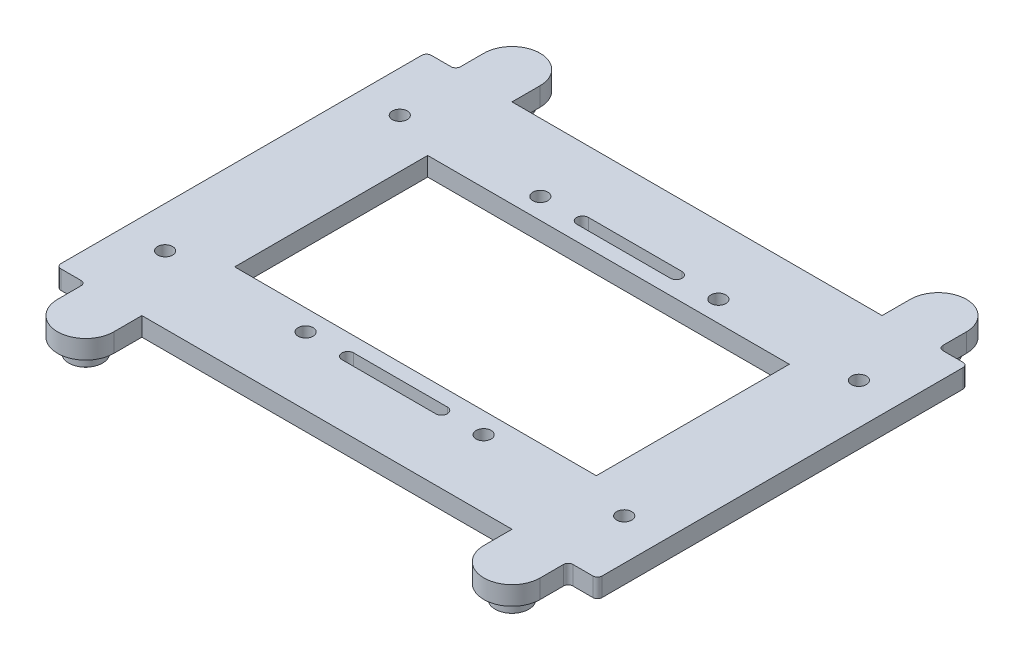
from build123d import *

# Parameters (mm, degrees)
EXTRUDE_1_DEPTH     = 4
SKETCH_4_R          = 3.6
EXTRUDE_2_DEPTH     = 3
EXTRUDE_2_2_DEPTH   = 3
EXTRUDE_2_3_DEPTH   = 3
EXTRUDE_2_4_DEPTH   = 3
SKETCH_5_R          = 1.8
EXTRUDE_3_DEPTH     = 1.3
EXTRUDE_3_2_DEPTH   = 1.3
EXTRUDE_3_3_DEPTH   = 1.3
EXTRUDE_3_4_DEPTH   = 1.3
SKETCH_10_W         = 77.2
SKETCH_10_H         = 41.2
CUT_EXTRUDE_5_DEPTH = 78.821606897
SKETCH_16_R         = 1.6
CUT_EXTRUDE_6_DEPTH = 10
FILLET_1_R          = 1


with BuildPart() as part:
    # 草图1 → 凸台-拉伸1 (new body)
    with BuildSketch(Plane(origin=(0, 0, 0), x_dir=(1, 0, 0), z_dir=(0, 1, 0))):
        with BuildLine():
            Line((-39.5, -39.5), (39.5, -39.5))
            Line((39.5, -39.5), (39.5, -45.5))
            ThreePointArc((39.5, -45.5), (45.5, -51.5), (51.5, -45.5))
            Line((51.5, -45.5), (51.5, -39.5))
            Line((51.5, -39.5), (57.75, -39.5))
            Line((57.75, -39.5), (57.75, 39.5))
            Line((57.75, 39.5), (51.5, 39.5))
            Line((51.5, 39.5), (51.5, 45.5))
            ThreePointArc((51.5, 45.5), (45.5, 51.5), (39.5, 45.5))
            Line((39.5, 45.5), (39.5, 39.5))
            Line((39.5, 39.5), (-39.5, 39.5))
            Line((-39.5, 39.5), (-39.5, 45.5))
            ThreePointArc((-39.5, 45.5), (-45.5, 51.5), (-51.5, 45.5))
            Line((-51.5, 45.5), (-51.5, 39.5))
            Line((-51.5, 39.5), (-57.75, 39.5))
            Line((-57.75, 39.5), (-57.75, -39.5))
            Line((-57.75, -39.5), (-51.5, -39.5))
            Line((-51.5, -39.5), (-51.5, -45.5))
            ThreePointArc((-51.5, -45.5), (-45.5, -51.5), (-39.5, -45.5))
            Line((-39.5, -45.5), (-39.5, -39.5))
        make_face()
    extrude(amount=-EXTRUDE_1_DEPTH)

    # 草图10 → 切除-拉伸5 (cut, through all)
    with BuildSketch(Plane(origin=(0, 0, 0), x_dir=(1, 0, 0), z_dir=(0, 1, 0))):
        Rectangle(SKETCH_10_W, SKETCH_10_H)
    extrude(amount=-CUT_EXTRUDE_5_DEPTH, mode=Mode.SUBTRACT)

    # 草图16 → 切除-拉伸6 (cut)
    with BuildSketch(Plane(origin=(0, 0, 0), x_dir=(1, 0, 0), z_dir=(0, 1, 0))):
        with Locations((19, 25.05)):
            Circle(SKETCH_16_R)
        with Locations((49, 25.05)):
            Circle(SKETCH_16_R)
        with Locations((-49, 25.05)):
            Circle(SKETCH_16_R)
        with Locations((-19, 25.05)):
            Circle(SKETCH_16_R)
        with Locations((49, -25.05)):
            Circle(SKETCH_16_R)
        with Locations((19, -25.05)):
            Circle(SKETCH_16_R)
        with Locations((-19, -25.05)):
            Circle(SKETCH_16_R)
        with Locations((-49, -25.05)):
            Circle(SKETCH_16_R)
        with BuildLine():
            Line((-10, 26.3), (10, 26.3))
            ThreePointArc((10, 26.3), (11.25, 25.05), (10, 23.8))
            Line((10, 23.8), (-10, 23.8))
            ThreePointArc((-10, 23.8), (-11.25, 25.05), (-10, 26.3))
        make_face()
        with BuildLine():
            Line((-10, -26.3), (10, -26.3))
            ThreePointArc((10, -26.3), (11.25, -25.05), (10, -23.8))
            Line((10, -23.8), (-10, -23.8))
            ThreePointArc((-10, -23.8), (-11.25, -25.05), (-10, -26.3))
        make_face()
    extrude(amount=-CUT_EXTRUDE_6_DEPTH, mode=Mode.SUBTRACT)

    # 圆角1
    fillet_1_edges = [part.edges().sort_by_distance(p)[0] for p in [
        (-51.5, -2, -39.5),
        (51.5, -2, -39.5),
        (51.5, -2, 39.5),
        (-51.5, -2, 39.5),
        (-57.75, -2, 39.5),
        (-57.75, -2, -39.5),
        (57.75, -2, 39.5),
        (57.75, -2, -39.5),
    ]]
    fillet(fillet_1_edges, radius=FILLET_1_R)


with BuildPart() as body_2:
    # 草图4 → 凸台-拉伸2 (new body)
    with BuildSketch(Plane.XZ.offset(4)):
        with Locations((-45.5, 45.5)):
            Circle(SKETCH_4_R)
    extrude(amount=EXTRUDE_2_DEPTH)


with BuildPart() as body_3:
    # 草图4 → Extrude 2 2 (new body)
    with BuildSketch(Plane.XZ.offset(4)):
        with Locations((-45.5, -45.5)):
            Circle(SKETCH_4_R)
    extrude(amount=EXTRUDE_2_2_DEPTH)


with BuildPart() as body_4:
    # 草图4 → Extrude 2 3 (new body)
    with BuildSketch(Plane.XZ.offset(4)):
        with Locations((45.5, -45.5)):
            Circle(SKETCH_4_R)
    extrude(amount=EXTRUDE_2_3_DEPTH)


with BuildPart() as body_5:
    # 草图4 → Extrude 2 4 (new body)
    with BuildSketch(Plane.XZ.offset(4)):
        with Locations((45.5, 45.5)):
            Circle(SKETCH_4_R)
    extrude(amount=EXTRUDE_2_4_DEPTH)


with BuildPart() as body_6:
    # 草图5 → 凸台-拉伸3 (new body)
    with BuildSketch(Plane.XZ.offset(7)):
        with Locations((-45.5, 45.5)):
            Circle(SKETCH_5_R)
    extrude(amount=EXTRUDE_3_DEPTH)


with BuildPart() as body_7:
    # 草图5 → Extrude 3 2 (new body)
    with BuildSketch(Plane.XZ.offset(7)):
        with Locations((-45.5, -45.5)):
            Circle(SKETCH_5_R)
    extrude(amount=EXTRUDE_3_2_DEPTH)


with BuildPart() as body_8:
    # 草图5 → Extrude 3 3 (new body)
    with BuildSketch(Plane.XZ.offset(7)):
        with Locations((45.5, -45.5)):
            Circle(SKETCH_5_R)
    extrude(amount=EXTRUDE_3_3_DEPTH)


with BuildPart() as body_9:
    # 草图5 → Extrude 3 4 (new body)
    with BuildSketch(Plane.XZ.offset(7)):
        with Locations((45.5, 45.5)):
            Circle(SKETCH_5_R)
    extrude(amount=EXTRUDE_3_4_DEPTH)


solid = Compound([part.part, body_2.part, body_3.part, body_4.part, body_5.part, body_6.part, body_7.part, body_8.part, body_9.part])
